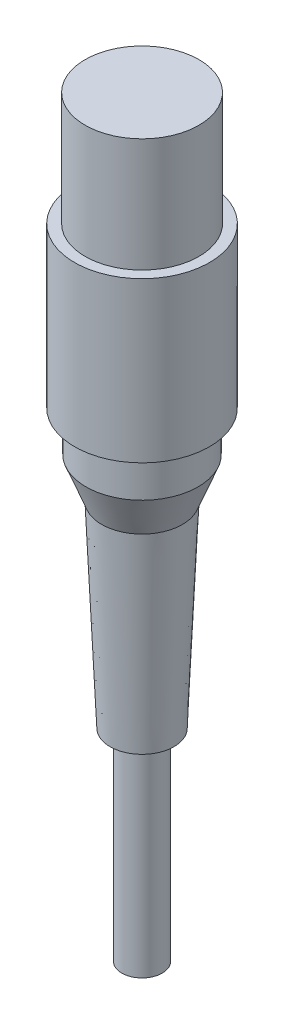
from build123d import *

# Parameters (mm, degrees)
SKETCH2_R           = 3
BOSS_EXTRUDE1_DEPTH = 30


with BuildPart() as part:
    # Sketch1 → Revolve1 (revolve)
    with BuildSketch(Plane.XY):
        Polygon((0, 81.78), (0, 41.21), (8.33, 41.21), (10.015, 41.21), (10.015, 64.9), (8.45, 64.9), (8.45, 81.78), align=None)
    revolve(axis=Axis((0, 0, 0), (0, 1, 0)))

    # Sketch1<3> → Revolve2 (revolve)
    with BuildSketch(Plane.XY):
        Polygon((0, 41.21), (0, 0), (4.75, 0), (6, 29.21), (8.33, 35.21), (8.33, 41.21), align=None)
    revolve(axis=Axis((0, 0, 0), (0, 1, 0)))

    # Sketch2 → Boss-Extrude1 (add)
    with BuildSketch(Plane.XZ):
        Circle(SKETCH2_R)
    extrude(amount=BOSS_EXTRUDE1_DEPTH)


solid = part.part
